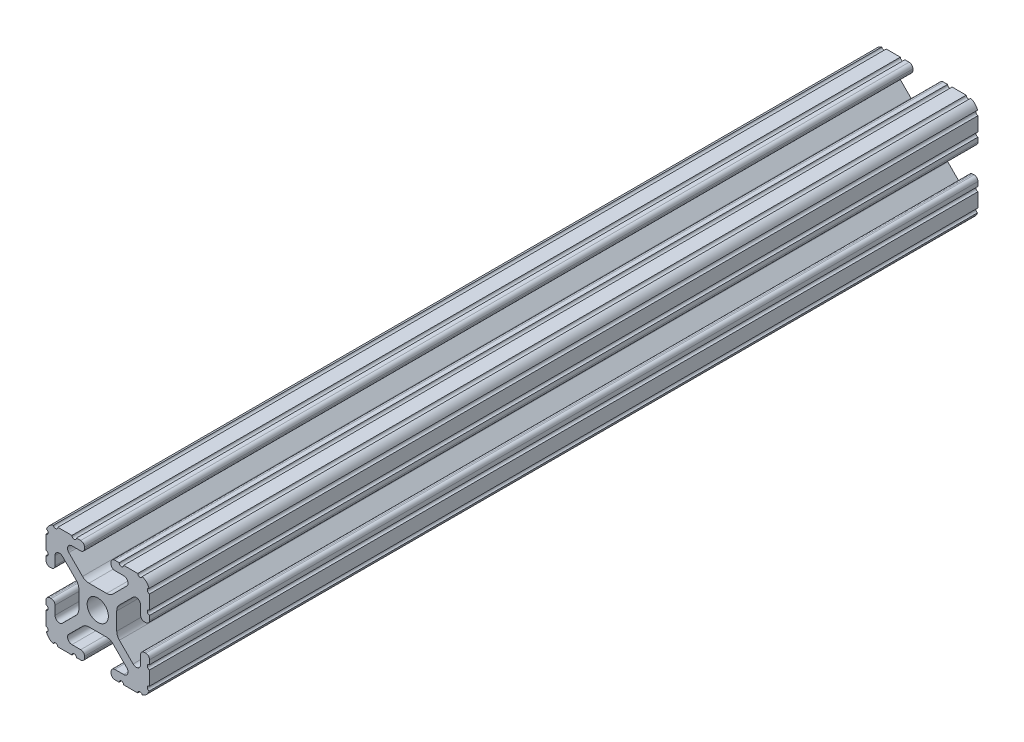
from build123d import *

# Parameters (mm, degrees)
BOSS_EXTRUDE1_DEPTH     = 101.6
CUT_EXTRUDE1_DEPTH      = 104.175287739
CUT_EXTRUDE1_DEPTH_BACK = 104.175287739
SKETCH5_R               = 0.55245


with BuildPart() as part:
    # Sketch4 → Boss-Extrude1 (new, symmetric)
    with BuildSketch(Plane.XY):
        with BuildLine():
            Line((4.190365, -12.7), (10.11729625, -12.7))
            ThreePointArc((10.11729625, -12.7), (11.943543585, -11.943543585), (12.7, -10.11729625))
            Line((12.7, -10.11729625), (12.7, -4.190365))
            ThreePointArc((12.7, -4.190365), (12.42492494, -3.52627506), (11.760835, -3.2512))
            Line((11.760835, -3.2512), (11.429365, -3.2512))
            ThreePointArc((11.429365, -3.2512), (10.76527506, -3.52627506), (10.4902, -4.190365))
            Line((10.4902, -4.190365), (10.4902, -6.348478019))
            ThreePointArc((10.4902, -6.348478019), (9.830707141, -7.335478831), (8.666460301, -7.103895736))
            Line((8.666460301, -7.103895736), (5.299899128, -3.737334563))
            ThreePointArc((5.299899128, -3.737334563), (4.817571085, -3.015479634), (4.6482, -2.16399369))
            Line((4.6482, -2.16399369), (4.6482, 0))
            Line((4.6482, 0), (2.6035, 0))
            ThreePointArc((2.6035, 0), (1.840952505, -1.840952505), (0, -2.6035))
            Line((0, -2.6035), (0, -4.6482))
            Line((0, -4.6482), (2.16399369, -4.6482))
            ThreePointArc((2.16399369, -4.6482), (3.015479634, -4.817571085), (3.737334563, -5.299899128))
            Line((3.737334563, -5.299899128), (7.103895736, -8.666460301))
            ThreePointArc((7.103895736, -8.666460301), (7.335478831, -9.830707141), (6.348478019, -10.4902))
            Line((6.348478019, -10.4902), (4.190365, -10.4902))
            ThreePointArc((4.190365, -10.4902), (3.52627506, -10.76527506), (3.2512, -11.429365))
            Line((3.2512, -11.429365), (3.2512, -11.760835))
            ThreePointArc((3.2512, -11.760835), (3.52627506, -12.42492494), (4.190365, -12.7))
        make_face()
    extrude(amount=BOSS_EXTRUDE1_DEPTH, both=True)

    # Sketch5 → Cut-Extrude1 (cut, two sides: drawn at the far end of the back side and taken through both)
    with BuildSketch(Plane.XY.offset(-CUT_EXTRUDE1_DEPTH_BACK)):
        with Locations((10.356153152, -12.7)):
            Circle(SKETCH5_R)
        with Locations((5.796028019, -12.7)):
            Circle(SKETCH5_R)
        with Locations((12.7, -10.356153152)):
            Circle(SKETCH5_R)
        with Locations((12.7, -5.796028019)):
            Circle(SKETCH5_R)
    extrude(amount=CUT_EXTRUDE1_DEPTH + CUT_EXTRUDE1_DEPTH_BACK, mode=Mode.SUBTRACT)

    # Mirror1: part across plane


with BuildPart() as part_1:
    add(part.part)
    add(part.part.mirror(Plane(origin=(0, 0, 0), x_dir=(0, 0, 1), z_dir=(1, 0, 0))))

    # Mirror2: part across plane


with BuildPart() as part_2:
    add(part_1.part)
    add(part_1.part.mirror(Plane.ZX))


solid = part_2.part
